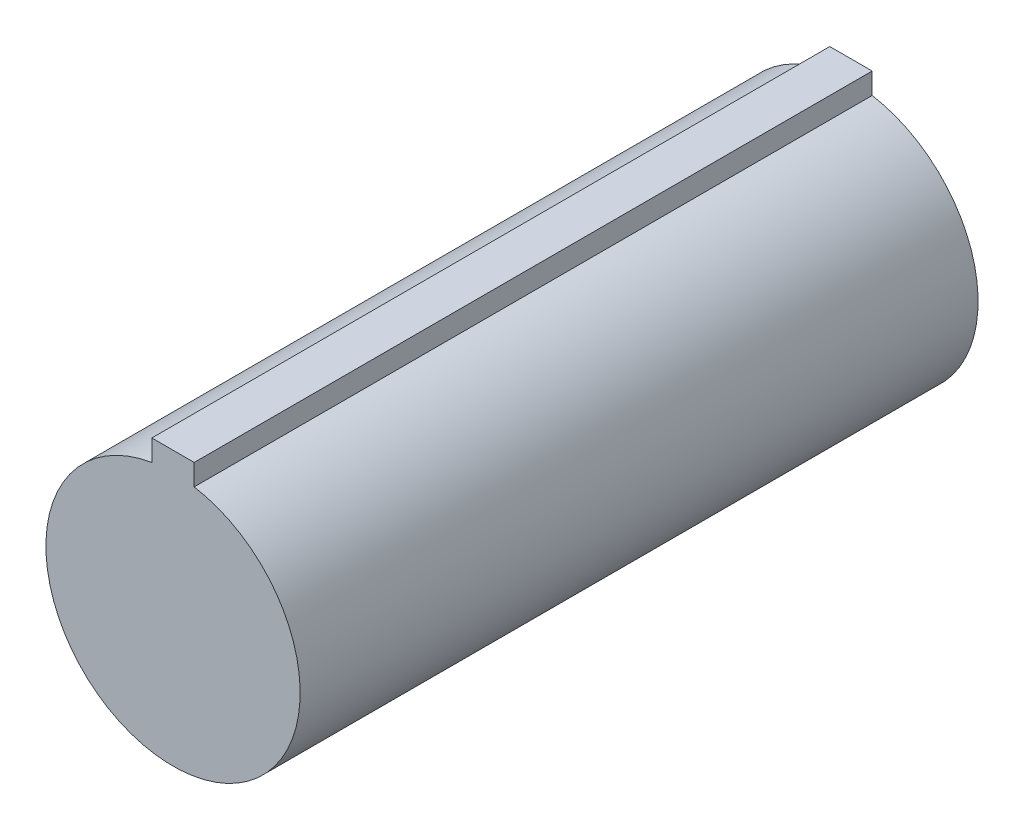
from build123d import *

# Parameters (mm, degrees)
SKETCH1_R           = 4.7625
SKETCH1_W           = 1.5875
SKETCH1_H           = 0.79375
BOSS_EXTRUDE1_DEPTH = 25.4


with BuildPart() as part:
    # Sketch1 → Boss-Extrude1 (new body)
    with BuildSketch(Plane.XY):
        with Locations((-1.639930211, 2.216369181)):
            Circle(SKETCH1_R)
        with Locations((-1.639930211, 7.309385865)):
            Rectangle(SKETCH1_W, SKETCH1_H)
    extrude(amount=BOSS_EXTRUDE1_DEPTH)


solid = part.part
